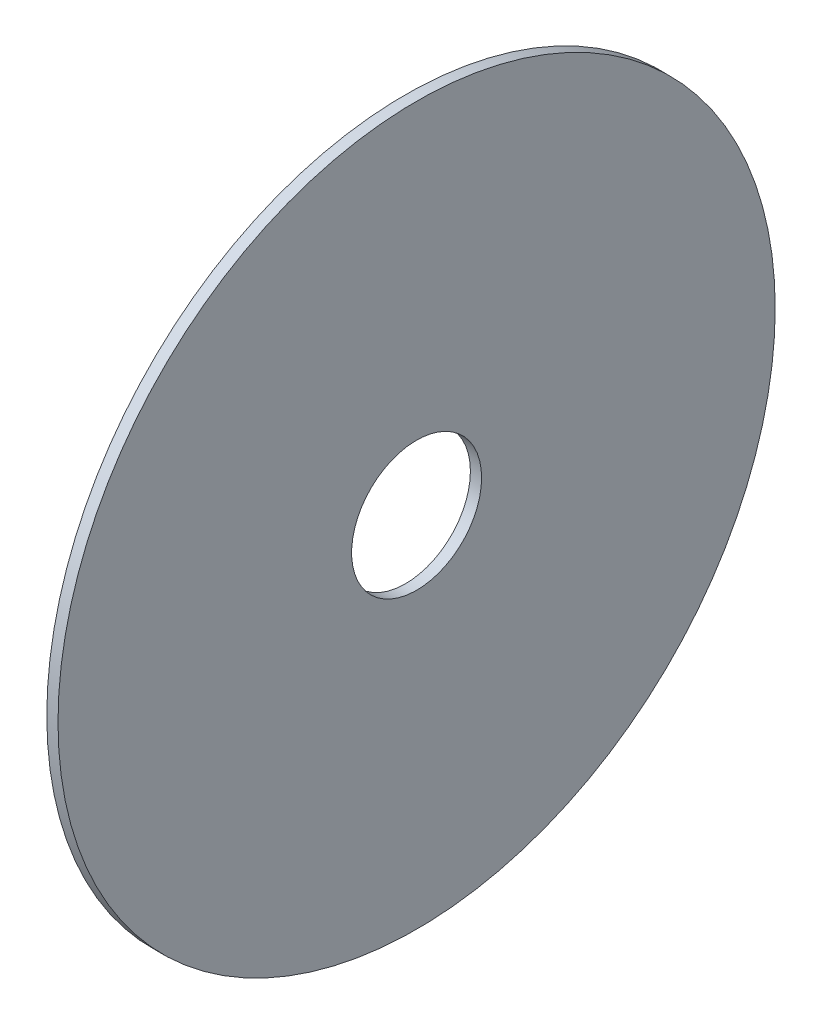
from build123d import *

# Parameters (mm, degrees)
SKETCH1_R           = 50.8
SKETCH1_R_2         = 9.2075
BOSS_EXTRUDE1_DEPTH = 0.79375


with BuildPart() as part:
    # Sketch1 → Boss-Extrude1 (new, symmetric)
    with BuildSketch(Plane(origin=(0, 0, 0), x_dir=(0, 0, -1), z_dir=(1, 0, 0))):
        Circle(SKETCH1_R)
        Circle(SKETCH1_R_2, mode=Mode.SUBTRACT)
    extrude(amount=BOSS_EXTRUDE1_DEPTH, both=True)


solid = part.part
